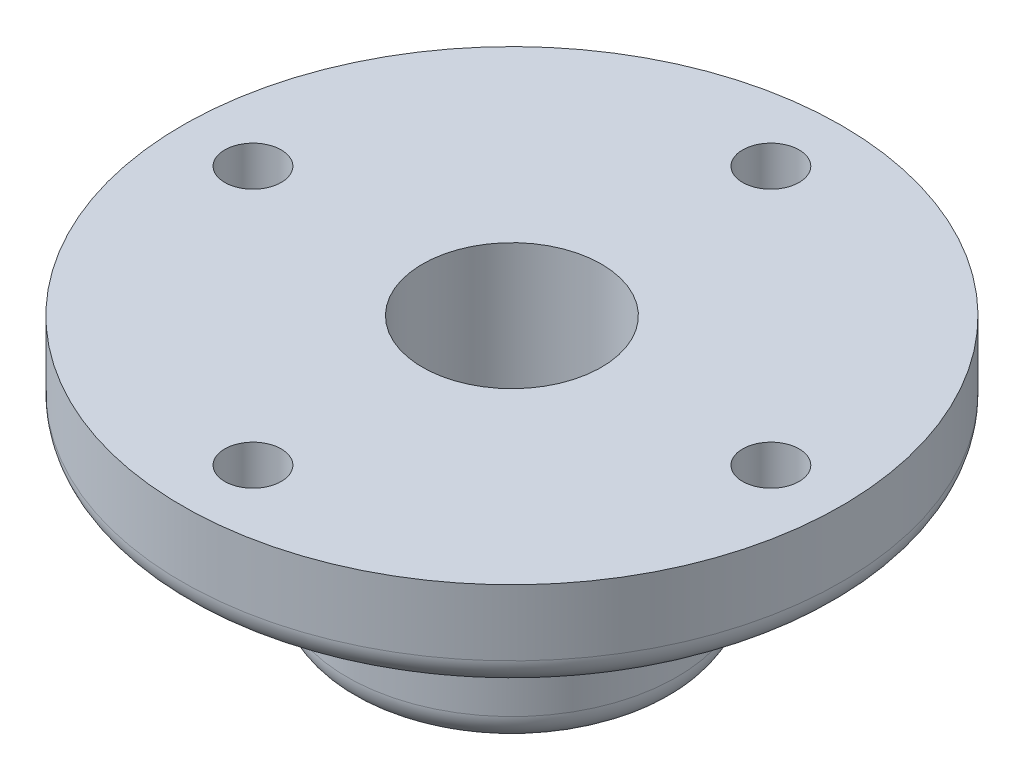
from build123d import *

# Parameters (mm, degrees)
SKETCH2_R          = 6
CUT_EXTRUDE1_DEPTH = 126.880896159


with BuildPart() as part:
    # Sketch1 → Revolve2 (revolve)
    with BuildSketch(Plane.XY, mode=Mode.PRIVATE) as revolve2_sk:
        with BuildLine():
            Line((0, 0), (10, 0))
            ThreePointArc((10, 0), (14.242640687, 1.757359313), (16, 6))
            Line((16, 6), (16, 29))
            ThreePointArc((16, 29), (17.757359313, 33.242640687), (22, 35))
            Line((22, 35), (45, 35))
            ThreePointArc((45, 35), (49.242640687, 36.757359313), (51, 41))
            Line((51, 41), (51, 55))
            Line((51, 55), (0, 55))
            Line((0, 55), (0, 0))
        make_face()
    revolve(revolve2_sk.sketch.rotate(Axis((-19, -10.4646853, 0), (0, 1, 0)), 90), axis=Axis((-19, -10.4646853, 0), (0, 1, 0)))

    # Sketch2 → Cut-Extrude1 (cut, through all)
    with BuildSketch(Plane(origin=(0, 55, 0), x_dir=(1, 0, 0), z_dir=(0, 1, 0))):
        with Locations(Location((-19, 55, 0), (0, 0, 270))):
            Circle(SKETCH2_R)
        with Locations(Location((-74, 0, 0), (0, 0, 270))):
            Circle(SKETCH2_R)
        with Locations(Location((-19, -55, 0), (0, 0, 270))):
            Circle(SKETCH2_R)
        with Locations(Location((36, 0, 0), (0, 0, 270))):
            Circle(SKETCH2_R)
    extrude(amount=-CUT_EXTRUDE1_DEPTH, mode=Mode.SUBTRACT)


solid = part.part
